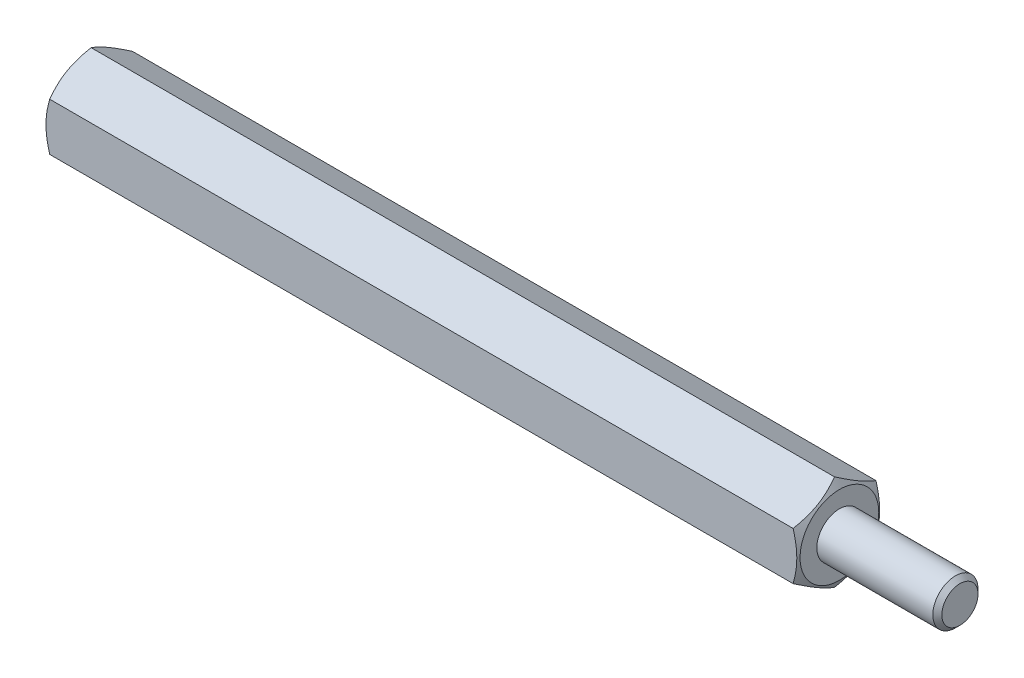
from build123d import *

# Parameters (mm, degrees)
BOSS_EXTRUDE1_DEPTH = 50
SKETCH2_R           = 1.5
BOSS_EXTRUDE2_DEPTH = 8
SKETCH3_R           = 1.5
CUT_EXTRUDE1_DEPTH  = 10
CHAMFER1_SIZE       = 0.3


with BuildPart() as part:
    # Sketch1 → Boss-Extrude1 (new body)
    with BuildSketch(Plane(origin=(0, 0, 0), x_dir=(0, 0, -1), z_dir=(1, 0, 0))):
        Polygon((0, 3.175426481), (-2.75, 1.58771324), (-2.75, -1.58771324), (0, -3.175426481), (2.75, -1.58771324), (2.75, 1.58771324), align=None)
    extrude(amount=BOSS_EXTRUDE1_DEPTH)

    # Sketch2 → Boss-Extrude2 (add)
    with BuildSketch(Plane(origin=(50, 0, 0), x_dir=(0, 0, -1), z_dir=(1, 0, 0))):
        Circle(SKETCH2_R)
    extrude(amount=BOSS_EXTRUDE2_DEPTH)

    # Sketch3 → Cut-Extrude1 (cut)
    with BuildSketch(Plane.ZY):
        with Locations(Location((0, 0, 0), (0, 0, 180))):
            Circle(SKETCH3_R)
    extrude(amount=-CUT_EXTRUDE1_DEPTH, mode=Mode.SUBTRACT)

    # Sketch4 → Cut-Revolve1 (revolve, cut)
    with BuildSketch(Plane(origin=(0, 0, 0), x_dir=(1, 0, 0), z_dir=(0, 1, 0)), mode=Mode.PRIVATE) as cut_revolve1_sk:
        Polygon((0, 10.219809024), (4.392081913, 10.219809024), (0, 2.6125), align=None)
        Polygon((50, 2.6125), (50, 10.219809024), (45.607918087, 10.219809024), align=None)
    revolve(cut_revolve1_sk.sketch.rotate(Axis((0, 0, 0), (-1, 0, 0)), 210.000000006), axis=Axis((0, 0, 0), (-1, 0, 0)), mode=Mode.SUBTRACT)

    # Chamfer1
    chamfer1_edges = [part.edges().sort_by_distance(p)[0] for p in [
        (58, 0, 1.5),
    ]]
    chamfer(chamfer1_edges, length=CHAMFER1_SIZE)


solid = part.part
